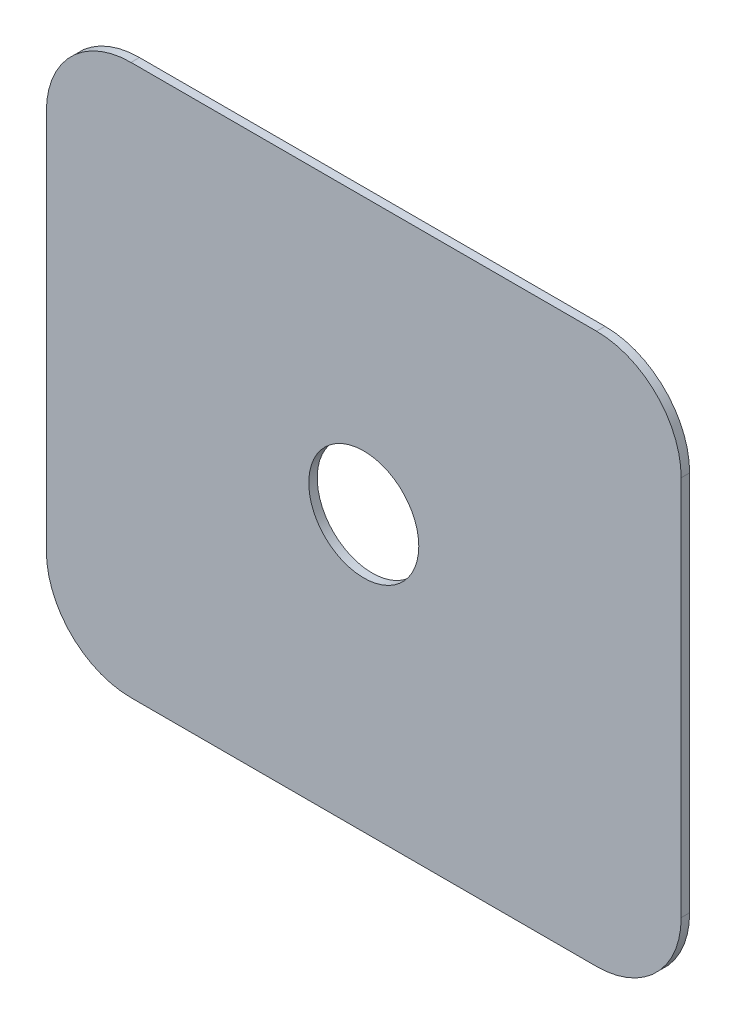
from build123d import *

# Parameters (mm, degrees)
SKETCH_1_W      = 150
SKETCH_1_H      = 130
SKETCH_1_R      = 13
EXTRUDE_1_DEPTH = 2
FILLET_1_R      = 20


with BuildPart() as part:
    # 草图1 → 凸台-拉伸1 (new body)
    with BuildSketch(Plane.XY):
        Rectangle(SKETCH_1_W, SKETCH_1_H)
        Circle(SKETCH_1_R, mode=Mode.SUBTRACT)
    extrude(amount=EXTRUDE_1_DEPTH)

    # 圆角1
    fillet_1_edges = [part.edges().sort_by_distance(p)[0] for p in [
        (75, -65, 1),
        (-75, -65, 1),
        (-75, 65, 1),
        (75, 65, 1),
    ]]
    fillet(fillet_1_edges, radius=FILLET_1_R)


solid = part.part
